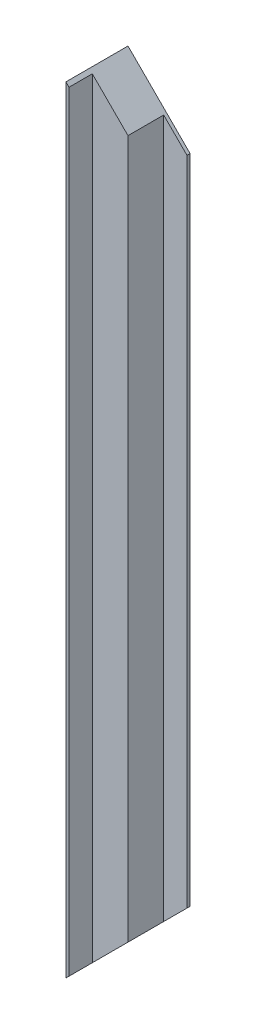
from build123d import *

# Parameters (mm, degrees)
SKETCH2_W           = 40
SKETCH2_H           = 500
BOSS_EXTRUDE1_DEPTH = 40
SKETCH3_W           = 15
SKETCH3_H           = 23
SKETCH3_H_2         = 15
SKETCH3_W_2         = 23
CUT_EXTRUDE1_DEPTH  = 1000
CUT_EXTRUDE2_DEPTH  = 1000


with BuildPart() as part:
    # Sketch2 → Boss-Extrude1 (new body)
    with BuildSketch(Plane.XY):
        with Locations((-324.597701149, 61.781609195)):
            Rectangle(SKETCH2_W, SKETCH2_H)
    extrude(amount=BOSS_EXTRUDE1_DEPTH)

    # Sketch3 → Cut-Extrude1 (cut)
    with BuildSketch(Plane(origin=(0, 311.781609195, 0), x_dir=(1, 0, 0), z_dir=(0, 1, 0))):
        with Locations((-312.097701149, -13.5)):
            Rectangle(SKETCH3_W, SKETCH3_H)
        with Locations((-312.097701149, -32.5)):
            Rectangle(SKETCH3_W, SKETCH3_H_2)
        with Locations((-331.097701149, -32.5)):
            Rectangle(SKETCH3_W_2, SKETCH3_H_2)
    extrude(amount=-CUT_EXTRUDE1_DEPTH, mode=Mode.SUBTRACT)

    # Sketch4 → Cut-Extrude2 (cut)
    with BuildSketch(Plane(origin=(0, 0, 0), x_dir=(-1, 0, 0), z_dir=(0, 0, -1))):
        Polygon((304.597701149, 311.781609195), (344.597701149, 311.781609195), (304.597701149, 271.781609195), align=None)
        Polygon((344.597701149, -188.218390805), (304.597701149, -188.218390805), (304.597701149, -148.218390805), align=None)
    extrude(amount=-CUT_EXTRUDE2_DEPTH, mode=Mode.SUBTRACT)


solid = part.part
